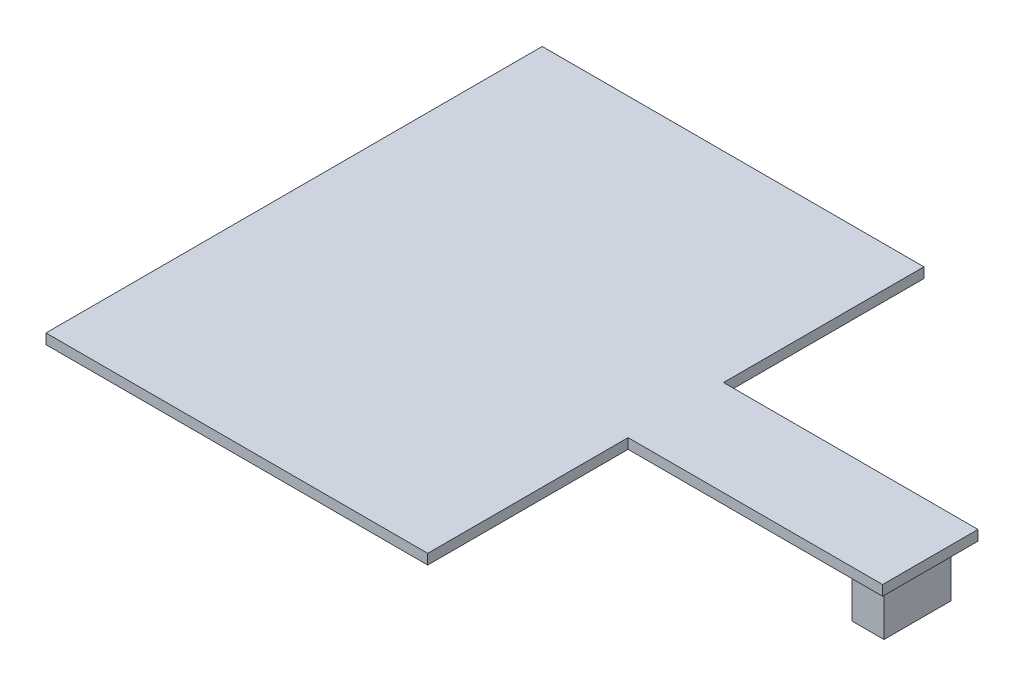
from build123d import *

# Parameters (mm, degrees)
SKETCH1_W           = 60
SKETCH1_H           = 78
SKETCH1_W_2         = 40
SKETCH1_H_2         = 15
BOSS_EXTRUDE1_DEPTH = 1.6
SKETCH2_W           = 5
SKETCH2_H           = 10.56
BOSS_EXTRUDE2_DEPTH = 8


with BuildPart() as part:
    # Sketch1 → Boss-Extrude1 (new body)
    with BuildSketch(Plane(origin=(0, 0, 0), x_dir=(1, 0, 0), z_dir=(0, 1, 0))):
        Rectangle(SKETCH1_W, SKETCH1_H)
        with Locations((50, 0)):
            Rectangle(SKETCH1_W_2, SKETCH1_H_2)
    extrude(amount=-BOSS_EXTRUDE1_DEPTH)

    # Sketch2 → Boss-Extrude2 (add)
    with BuildSketch(Plane.XZ.offset(1.6)):
        with Locations((65.5, 0)):
            Rectangle(SKETCH2_W, SKETCH2_H)
    extrude(amount=BOSS_EXTRUDE2_DEPTH)


solid = part.part
